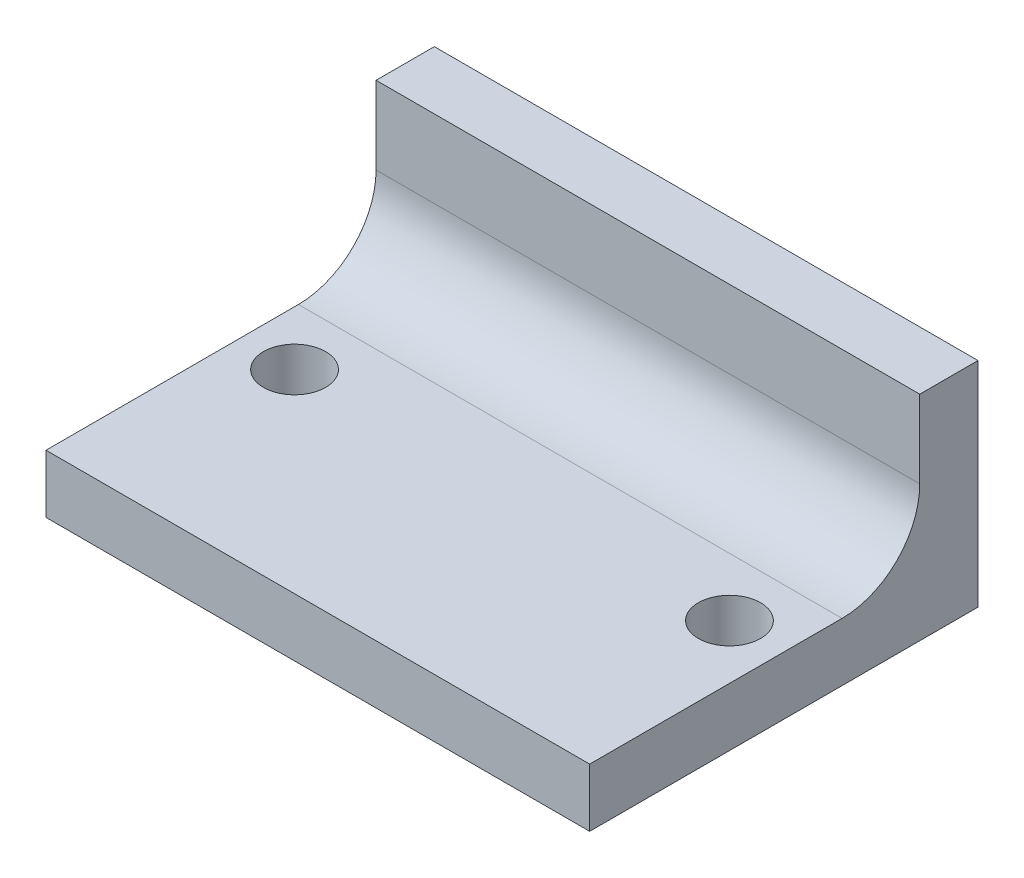
from build123d import *

# Parameters (mm, degrees)
SKETCH3_W           = 70
SKETCH3_H           = 50
SKETCH3_R           = 4
BOSS_EXTRUDE1_DEPTH = 7.5
SKETCH4_W           = 70
SKETCH4_H           = 7.5
BOSS_EXTRUDE2_DEPTH = 20
FILLET3_R           = 10


with BuildPart() as part:
    # Sketch3 → Boss-Extrude1 (new body)
    with BuildSketch(Plane(origin=(0, 0, 0), x_dir=(1, 0, 0), z_dir=(0, 1, 0))):
        with Locations((4.469051839, 0.071060676)):
            Rectangle(SKETCH3_W, SKETCH3_H)
        with Locations(Location((32.469051839, 0.071060676, 0), (0, 0, 270))):
            Circle(SKETCH3_R, mode=Mode.SUBTRACT)
        with Locations(Location((-23.530948161, 0.071060676, 0), (0, 0, 90))):
            Circle(SKETCH3_R, mode=Mode.SUBTRACT)
    extrude(amount=BOSS_EXTRUDE1_DEPTH)

    # Sketch4 → Boss-Extrude2 (add)
    with BuildSketch(Plane(origin=(0, 7.5, 0), x_dir=(1, 0, 0), z_dir=(0, 1, 0))):
        with Locations((4.469051839, 21.321060676)):
            Rectangle(SKETCH4_W, SKETCH4_H)
    extrude(amount=BOSS_EXTRUDE2_DEPTH)

    # Fillet3
    fillet3_edges = [part.edges().sort_by_distance(p)[0] for p in [
        (4.469051839, 7.5, -17.571060676),
    ]]
    fillet(fillet3_edges, radius=FILLET3_R)


solid = part.part
